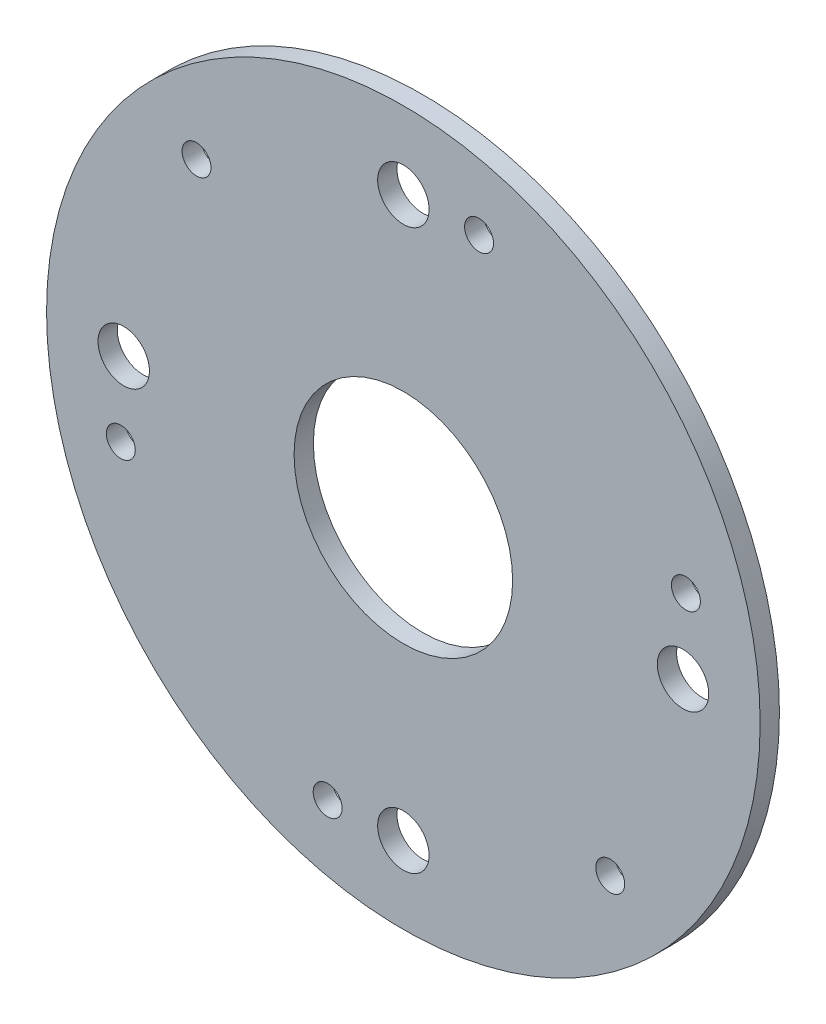
from build123d import *

# Parameters (mm, degrees)
CARRIER_FRONT_START = 44.5
SKETCH_1_R          = 55.5
SKETCH_1_R_2        = 17
CARRIER_FRONT_DEPTH = 3
SKETCH_2_R          = 2.25
THROUGH_HOLES_DEPTH = 100
SKETCH_3_R          = 4
CUT_EXTRUDE_2_DEPTH = 100


with BuildPart() as part:
    # Эскиз1 → Carrier_front (new body)
    with BuildSketch(Plane.XY.offset(CARRIER_FRONT_START)):
        Circle(SKETCH_1_R)
        Circle(SKETCH_1_R_2, mode=Mode.SUBTRACT)
    extrude(amount=CARRIER_FRONT_DEPTH)

    # Эскиз2 → Through_holes (cut, symmetric)
    with BuildSketch(Plane.XY):
        with Locations((43.5, 0)):
            Circle(SKETCH_2_R)
        with Locations((0, 43.5)):
            Circle(SKETCH_2_R)
        with Locations((-43.5, 0)):
            Circle(SKETCH_2_R)
        with Locations((0, -43.5)):
            Circle(SKETCH_2_R)
        with Locations((43.949625096, 11.776266552)):
            Circle(SKETCH_2_R)
        with Locations((11.776266552, 43.949625096)):
            Circle(SKETCH_2_R)
        with Locations((-32.173358544, 32.173358544)):
            Circle(SKETCH_2_R)
        with Locations((-43.949625096, -11.776266552)):
            Circle(SKETCH_2_R)
        with Locations((-11.776266552, -43.949625096)):
            Circle(SKETCH_2_R)
        with Locations((32.173358544, -32.173358544)):
            Circle(SKETCH_2_R)
    extrude(amount=THROUGH_HOLES_DEPTH, both=True, mode=Mode.SUBTRACT)

    # Эскиз3 → Вырез-Вытянуть2 (cut, symmetric)
    with BuildSketch(Plane.XY):
        with Locations((43.5, 0)):
            Circle(SKETCH_3_R)
        with Locations((0, 43.5)):
            Circle(SKETCH_3_R)
        with Locations((-43.5, 0)):
            Circle(SKETCH_3_R)
        with Locations((0, -43.5)):
            Circle(SKETCH_3_R)
    extrude(amount=CUT_EXTRUDE_2_DEPTH, both=True, mode=Mode.SUBTRACT)


solid = part.part
